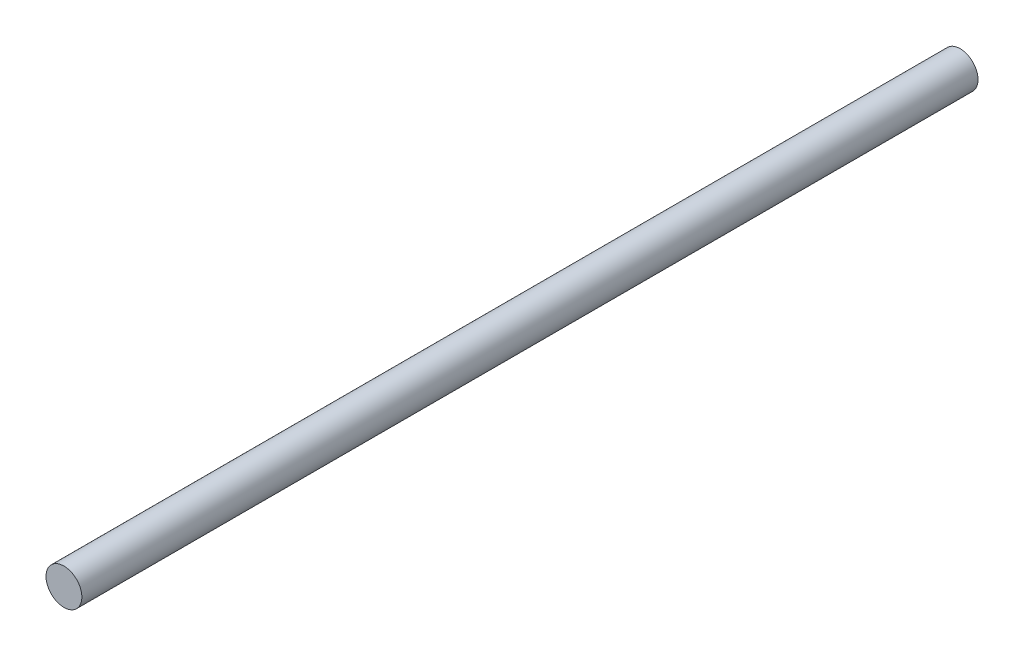
from build123d import *

# Parameters (mm, degrees)
SKETCH1_R           = 25.4
BOSS_EXTRUDE1_DEPTH = 1270


with BuildPart() as part:
    # Sketch1 → Boss-Extrude1 (new body)
    with BuildSketch(Plane.XY):
        with Locations(Location((0, 0, 0), (0, 0, 180))):
            Circle(SKETCH1_R)
    extrude(amount=BOSS_EXTRUDE1_DEPTH)


solid = part.part
